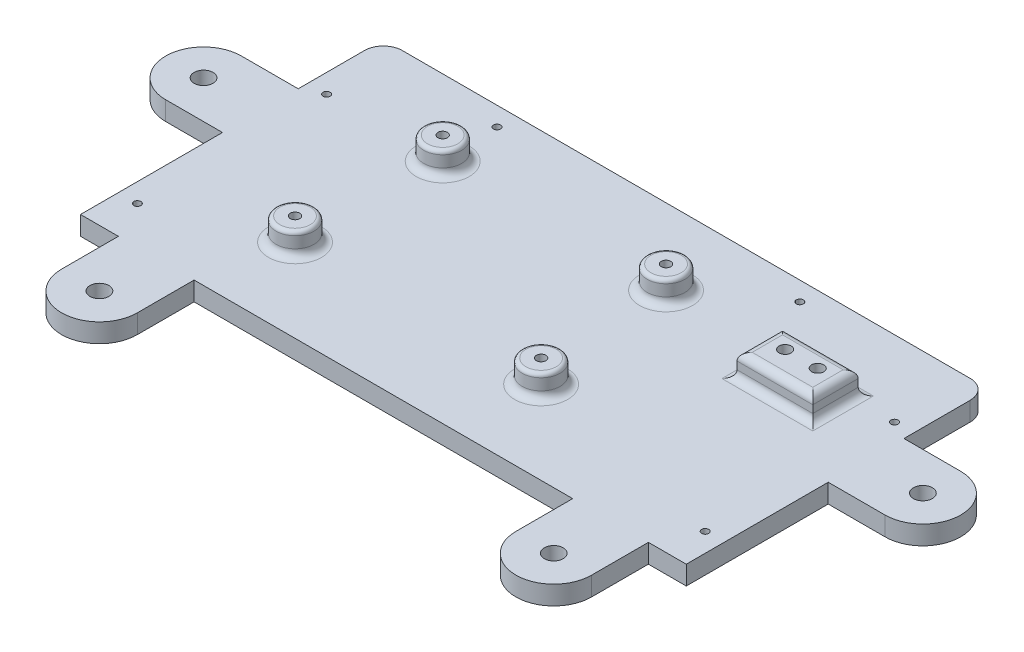
from build123d import *

# Parameters (mm, degrees)
SKETCH1_R           = 1.190625
BOSS_EXTRUDE1_DEPTH = 6.35
SKETCH2_R           = 6.35
BOSS_EXTRUDE2_DEPTH = 7.62
FILLET1_R           = 2.54
FILLET2_R           = 1.27
SKETCH5_R           = 1.5875
CUT_EXTRUDE1_DEPTH  = 228.613621956
SKETCH6_R           = 3.175
BOSS_EXTRUDE3_DEPTH = 6.35
SKETCH7_W           = 25.4
SKETCH7_H           = 15.24
BOSS_EXTRUDE4_DEPTH = 7.62
SKETCH9_R           = 2.032
CUT_EXTRUDE2_DEPTH  = 257.35760843
FILLET3_R           = 2.54


with BuildPart() as part:
    # Sketch1 → Boss-Extrude1 (new body)
    with BuildSketch(Plane(origin=(0, 0, 0), x_dir=(1, 0, 0), z_dir=(0, 1, 0))):
        with BuildLine():
            Line((0, 0), (203.2, 0))
            Line((203.2, 0), (203.2, 95.25))
            ThreePointArc((203.2, 95.25), (201.340128061, 99.740128061), (196.85, 101.6))
            Line((196.85, 101.6), (6.35, 101.6))
            ThreePointArc((6.35, 101.6), (1.859871939, 99.740128061), (0, 95.25))
            Line((0, 95.25), (0, 0))
        make_face()
        with Locations(Location((6.35, 12.7, 0), (0, 0, 270))):
            Circle(SKETCH1_R, mode=Mode.SUBTRACT)
        with Locations(Location((196.85, 76.2, 0), (0, 0, 90))):
            Circle(SKETCH1_R, mode=Mode.SUBTRACT)
        with Locations(Location((6.35, 76.2, 0), (0, 0, 270))):
            Circle(SKETCH1_R, mode=Mode.SUBTRACT)
        with Locations(Location((44.45, 95.25, 0), (0, 0, 270))):
            Circle(SKETCH1_R, mode=Mode.SUBTRACT)
        with Locations(Location((146.05, 95.25, 0), (0, 0, 270))):
            Circle(SKETCH1_R, mode=Mode.SUBTRACT)
        with Locations(Location((196.85, 12.7, 0), (0, 0, 90))):
            Circle(SKETCH1_R, mode=Mode.SUBTRACT)
    extrude(amount=BOSS_EXTRUDE1_DEPTH)

    # Sketch2 → Boss-Extrude2 (add)
    with BuildSketch(Plane(origin=(0, 6.35, 0), x_dir=(1, 0, 0), z_dir=(0, 1, 0))):
        with Locations(Location((45.295058165, 76.2, 0), (0, 0, 90))):
            Circle(SKETCH2_R)
        with Locations(Location((120.225058165, 76.2, 0), (0, 0, 90))):
            Circle(SKETCH2_R)
        with Locations(Location((44.025058165, 27.94, 0), (0, 0, 90))):
            Circle(SKETCH2_R)
        with Locations(Location((126.575058165, 27.94, 0), (0, 0, 90))):
            Circle(SKETCH2_R)
    extrude(amount=BOSS_EXTRUDE2_DEPTH)

    # Fillet1
    fillet1_edges = [part.edges().sort_by_distance(p)[0] for p in [
        (45.295058165, 6.35, -69.85),
        (120.225058165, 6.35, -69.85),
        (44.025058165, 6.35, -21.59),
        (126.575058165, 6.35, -21.59),
    ]]
    fillet(fillet1_edges, radius=FILLET1_R)

    # Fillet2
    fillet2_edges = [part.edges().sort_by_distance(p)[0] for p in [
        (45.295058165, 13.97, -69.85),
        (120.225058165, 13.97, -69.85),
        (44.025058165, 13.97, -21.59),
        (126.575058165, 13.97, -21.59),
    ]]
    fillet(fillet2_edges, radius=FILLET2_R)

    # Sketch5 → Cut-Extrude1 (cut, through all)
    with BuildSketch(Plane(origin=(0, 13.97, 0), x_dir=(1, 0, 0), z_dir=(0, 1, 0))):
        with Locations(Location((45.295058165, 76.2, 0), (0, 0, 270))):
            Circle(SKETCH5_R)
        with Locations(Location((120.225058165, 76.2, 0), (0, 0, 270))):
            Circle(SKETCH5_R)
        with Locations(Location((126.575058165, 27.94, 0), (0, 0, 270))):
            Circle(SKETCH5_R)
        with Locations(Location((44.025058165, 27.94, 0), (0, 0, 270))):
            Circle(SKETCH5_R)
    extrude(amount=-CUT_EXTRUDE1_DEPTH, mode=Mode.SUBTRACT)

    # Sketch6 → Boss-Extrude3 (add)
    # profile 1 of 4: a face of its own
    with BuildSketch(Plane(origin=(0, 6.35, 0), x_dir=(1, 0, 0), z_dir=(0, 1, 0))):
        with BuildLine():
            Line((0, 73.025), (-19.05, 73.025))
            ThreePointArc((-19.05, 73.025), (-31.75, 60.325), (-19.05, 47.625))
            Line((-19.05, 47.625), (0, 47.625))
            Line((0, 47.625), (0, 73.025))
        make_face()
        with Locations(Location((-19.05, 60.325, 0), (0, 0, 270))):
            Circle(SKETCH6_R, mode=Mode.SUBTRACT)
    # profile 2 of 4: a face of its own
    with BuildSketch(Plane(origin=(0, 6.35, 0), x_dir=(1, 0, 0), z_dir=(0, 1, 0))):
        with BuildLine():
            Line((12.7, 0), (38.1, 0))
            Line((38.1, 0), (38.1, -19.05))
            ThreePointArc((38.1, -19.05), (25.4, -31.75), (12.7, -19.05))
            Line((12.7, -19.05), (12.7, 0))
        make_face()
        with Locations(Location((25.4, -19.05, 0), (0, 0, 270))):
            Circle(SKETCH6_R, mode=Mode.SUBTRACT)
    # profile 3 of 4: a face of its own
    with BuildSketch(Plane(origin=(0, 6.35, 0), x_dir=(1, 0, 0), z_dir=(0, 1, 0))):
        with BuildLine():
            Line((190.5, 0), (165.1, 0))
            Line((165.1, 0), (165.1, -19.05))
            ThreePointArc((165.1, -19.05), (177.8, -31.75), (190.5, -19.05))
            Line((190.5, -19.05), (190.5, 0))
        make_face()
        with Locations(Location((177.8, -19.05, 0), (0, 0, 270))):
            Circle(SKETCH6_R, mode=Mode.SUBTRACT)
    # profile 4 of 4: a face of its own
    with BuildSketch(Plane(origin=(0, 6.35, 0), x_dir=(1, 0, 0), z_dir=(0, 1, 0))):
        with BuildLine():
            Line((203.2, 47.625), (222.25, 47.625))
            ThreePointArc((222.25, 47.625), (234.95, 60.325), (222.25, 73.025))
            Line((222.25, 73.025), (203.2, 73.025))
            Line((203.2, 73.025), (203.2, 47.625))
        make_face()
        with Locations(Location((222.25, 60.325, 0), (0, 0, 270))):
            Circle(SKETCH6_R, mode=Mode.SUBTRACT)
    extrude(amount=-BOSS_EXTRUDE3_DEPTH)

    # Sketch7 → Boss-Extrude4 (add)
    with BuildSketch(Plane(origin=(0, 6.35, 0), x_dir=(1, 0, 0), z_dir=(0, 1, 0))):
        with Locations((170.489279239, 70.073074686)):
            Rectangle(SKETCH7_W, SKETCH7_H)
    extrude(amount=BOSS_EXTRUDE4_DEPTH)

    # Sketch9 → Cut-Extrude2 (cut, through all)
    with BuildSketch(Plane(origin=(0, 13.97, 0), x_dir=(1, 0, 0), z_dir=(0, 1, 0))):
        with Locations(Location((175.950279239, 71.343074686, 0), (0, 0, 270))):
            Circle(SKETCH9_R)
        with Locations(Location((165.028279239, 71.343074686, 0), (0, 0, 270))):
            Circle(SKETCH9_R)
    extrude(amount=-CUT_EXTRUDE2_DEPTH, mode=Mode.SUBTRACT)

    # Fillet3
    fillet3_edges = [part.edges().sort_by_distance(p)[0] for p in [
        (183.189279239, 6.35, -70.073074686),
        (170.489279239, 6.35, -77.693074686),
        (157.789279239, 6.35, -70.073074686),
        (170.489279239, 6.35, -62.453074686),
        (170.489279239, 13.97, -62.453074686),
        (183.189279239, 13.97, -70.073074686),
        (170.489279239, 13.97, -77.693074686),
        (157.789279239, 13.97, -70.073074686),
    ]]
    fillet(fillet3_edges, radius=FILLET3_R)


solid = part.part
